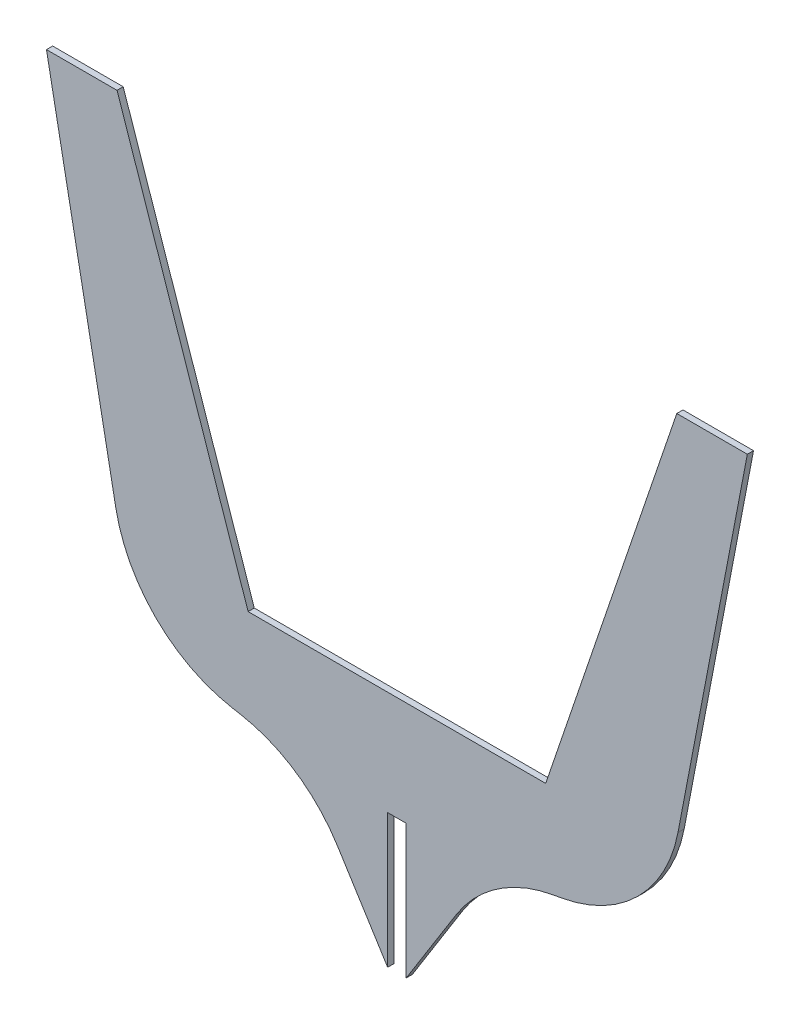
from build123d import *

# Parameters (mm, degrees)
BOSS_EXTRU_3_DEPTH = 3
CONG_2_R           = 70


with BuildPart() as part:
    # Esquisse3 → Boss.-Extru.3 (new body)
    with BuildSketch(Plane.XY):
        Polygon((-52.277721614, 1.004022038), (29.829851332, -13.926203114), (70.552829187, -78.926203114), (70.552829187, -13.926203114), (79.552829187, -13.926203114), (79.552829187, -78.926203114), (120.275807042, -13.926203114), (202.383379989, 1.004022038), (245.052829187, 223.873796886), (210.825087382, 223.873796886), (147.229762937, 36.664572693), (2.875895437, 36.664572693), (-60.719429007, 223.873796886), (-94.947170813, 223.873796886), align=None)
    extrude(amount=BOSS_EXTRU_3_DEPTH)

    # Congé2
    cong_2_edges = [part.edges().sort_by_distance(p)[0] for p in [
        (202.383379989, 1.004022038, 1.5),
        (120.275807042, -13.926203114, 1.5),
        (29.829851332, -13.926203114, 1.5),
        (-52.277721614, 1.004022038, 1.5),
    ]]
    fillet(cong_2_edges, radius=CONG_2_R)


solid = part.part
